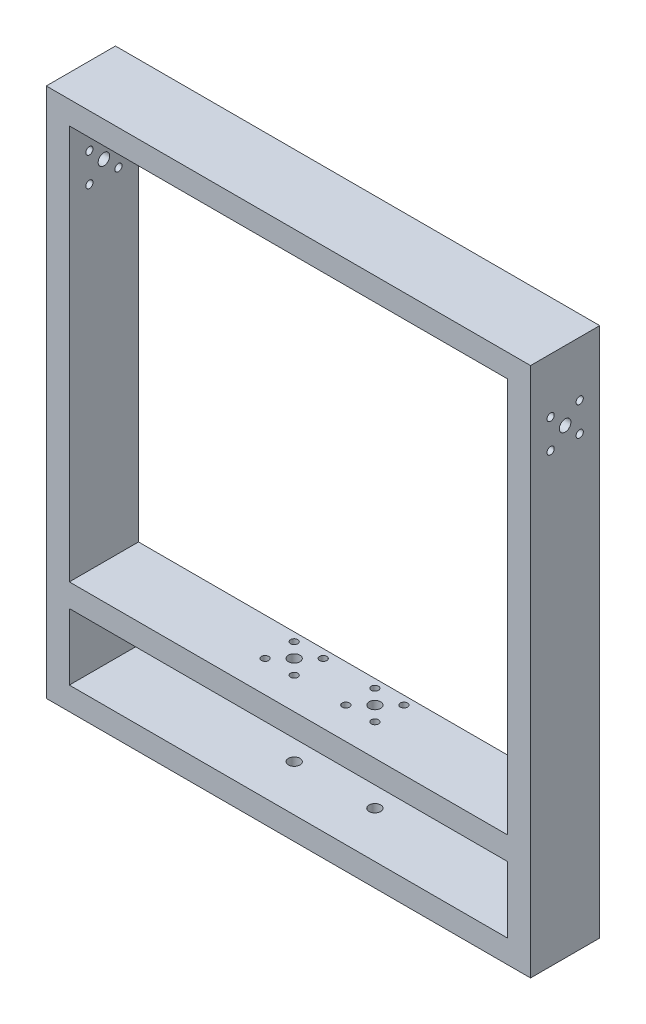
from build123d import *

# Parameters (mm, degrees)
ESQUISSE1_W             = 266.7
ESQUISSE1_H             = 38.1
BOSS_EXTRU_1_DEPTH      = 12.7
ESQUISSE2_W             = 12.7
ESQUISSE2_H             = 38.1
BOSS_EXTRU_2_DEPTH      = 279.4
ESQUISSE3_R             = 3.175
ENL_V_MAT_EXTRU_1_DEPTH = 311.176538442
ESQUISSE4_R             = 3.175
ENL_V_MAT_EXTRU_2_DEPTH = 311.176538442
BOSS_EXTRU_3_REACH      = 389.558
ESQUISSE5_W             = 38.1
ESQUISSE5_H             = 12.7
BOSS_EXTRU_4_REACH      = 389.558
ESQUISSE6_W             = 38.1
ESQUISSE6_H             = 12.7
ESQUISSE9_R             = 3.175
ENL_V_MAT_EXTRU_3_DEPTH = 396.997730423
ESQUISSE10_R            = 2
ENL_V_MAT_EXTRU_4_DEPTH = 396.997730423
ESQUISSE12_R            = 4.7625
ENL_V_MAT_EXTRU_5_DEPTH = 4.7625
ESQUISSE13_R            = 4.7625
ENL_V_MAT_EXTRU_6_DEPTH = 4.7625
ENL_V_START             = -76.2
ESQUISSE17_R            = 3.175
ENL_V_MAT_EXTRU_7_DEPTH = 76.2
ESQUISSE18_R            = 2
ENL_V_MAT_EXTRU_8_DEPTH = 25.4
ESQUISSE20_R            = 3.96875
ENL_V_MAT_EXTRU_9_DEPTH = 4.7625


with BuildPart() as part:
    # Esquisse1 → Boss.-Extru.1 (new body)
    with BuildSketch(Plane(origin=(0, 0, 0), x_dir=(1, 0, 0), z_dir=(0, 1, 0))):
        Rectangle(ESQUISSE1_W, ESQUISSE1_H)
    extrude(amount=BOSS_EXTRU_1_DEPTH)

    # Esquisse2 → Boss.-Extru.2 (add)
    with BuildSketch(Plane(origin=(0, 12.7, 0), x_dir=(1, 0, 0), z_dir=(0, 1, 0))):
        with Locations((-127, 0)):
            Rectangle(ESQUISSE2_W, ESQUISSE2_H)
        with Locations((127, 0)):
            Rectangle(ESQUISSE2_W, ESQUISSE2_H)
    extrude(amount=BOSS_EXTRU_2_DEPTH)

    # Esquisse3 → Enlèv. mat.-Extru.1 (cut, through all)
    with BuildSketch(Plane(origin=(0, 12.7, 0), x_dir=(1, 0, 0), z_dir=(0, 1, 0))):
        with Locations(Location((-22.225, 6.35, 0), (0, 0, 270))):
            Circle(ESQUISSE3_R)
    extrude(amount=-ENL_V_MAT_EXTRU_1_DEPTH, mode=Mode.SUBTRACT)

    # Esquisse4 → Enlèv. mat.-Extru.2 (cut, through all)
    with BuildSketch(Plane(origin=(0, 12.7, 0), x_dir=(1, 0, 0), z_dir=(0, 1, 0))):
        with Locations(Location((22.225, 6.35, 0), (0, 0, 270))):
            Circle(ESQUISSE4_R)
    extrude(amount=-ENL_V_MAT_EXTRU_2_DEPTH, mode=Mode.SUBTRACT)

    # Esquisse5 → Boss.-Extru.3 (add, up to next)
    with BuildSketch(Plane(origin=(-120.65, 0, 0), x_dir=(0, 0, -1), z_dir=(1, 0, 0)), mode=Mode.PRIVATE) as boss_extru_3_sk1:
        with Locations((0, 55.5625)):
            Rectangle(ESQUISSE5_W, ESQUISSE5_H)
    boss_extru_3_tool1 = extrude(boss_extru_3_sk1.sketch, amount=BOSS_EXTRU_3_REACH, mode=Mode.PRIVATE) - part.part
    add(boss_extru_3_tool1.solids().sort_by_distance((-120.65, 55.5625, 0))[0])

    # Esquisse6 → Boss.-Extru.4 (add, up to next)
    with BuildSketch(Plane(origin=(-120.65, 0, 0), x_dir=(0, 0, -1), z_dir=(1, 0, 0)), mode=Mode.PRIVATE) as boss_extru_4_sk1:
        with Locations((0, 285.75)):
            Rectangle(ESQUISSE6_W, ESQUISSE6_H)
    boss_extru_4_tool1 = extrude(boss_extru_4_sk1.sketch, amount=BOSS_EXTRU_4_REACH, mode=Mode.PRIVATE) - part.part
    add(boss_extru_4_tool1.solids().sort_by_distance((-120.65, 285.75, 0))[0])

    # Esquisse9 → Enlèv. mat.-Extru.3 (cut, through all)
    with BuildSketch(Plane.ZY.offset(133.35)):
        with Locations((0, 254)):
            Circle(ESQUISSE9_R)
    extrude(amount=-ENL_V_MAT_EXTRU_3_DEPTH, mode=Mode.SUBTRACT)

    # Esquisse10 → Enlèv. mat.-Extru.4 (cut, through all)
    with BuildSketch(Plane.ZY.offset(133.35)):
        with Locations((8, 262)):
            Circle(ESQUISSE10_R)
        with Locations((-8, 262)):
            Circle(ESQUISSE10_R)
        with Locations((-8, 246)):
            Circle(ESQUISSE10_R)
        with Locations((8, 246)):
            Circle(ESQUISSE10_R)
    extrude(amount=-ENL_V_MAT_EXTRU_4_DEPTH, mode=Mode.SUBTRACT)

    # Esquisse12 → Enlèv. mat.-Extru.5 (cut)
    with BuildSketch(Plane.ZY.offset(133.35)):
        with Locations((8, 262)):
            Circle(ESQUISSE12_R)
        with Locations((-8, 262)):
            Circle(ESQUISSE12_R)
        with Locations((-8, 246)):
            Circle(ESQUISSE12_R)
        with Locations((8, 246)):
            Circle(ESQUISSE12_R)
    extrude(amount=-ENL_V_MAT_EXTRU_5_DEPTH, mode=Mode.SUBTRACT)

    # Esquisse13 → Enlèv. mat.-Extru.6 (cut)
    with BuildSketch(Plane(origin=(120.65, 0, 0), x_dir=(0, 0, -1), z_dir=(1, 0, 0))):
        with Locations(Location((8, 262, 0), (0, 0, 180))):
            Circle(ESQUISSE13_R)
        with Locations(Location((8, 246, 0), (0, 0, 180))):
            Circle(ESQUISSE13_R)
        with Locations(Location((-8, 246, 0), (0, 0, 180))):
            Circle(ESQUISSE13_R)
        with Locations(Location((-8, 262, 0), (0, 0, 180))):
            Circle(ESQUISSE13_R)
    extrude(amount=ENL_V_MAT_EXTRU_6_DEPTH, mode=Mode.SUBTRACT)

    # Esquisse17 → Enlèv. mat.-Extru.7 (cut)
    with BuildSketch(Plane.XZ.offset(ENL_V_START)):
        with Locations(Location((22.225, -6.35, 0), (0, 0, 90))):
            Circle(ESQUISSE17_R)
        with Locations(Location((-22.225, -6.35, 0), (0, 0, 90))):
            Circle(ESQUISSE17_R)
    extrude(amount=ENL_V_MAT_EXTRU_7_DEPTH, mode=Mode.SUBTRACT)

    # Esquisse18 → Enlèv. mat.-Extru.8 (cut)
    with BuildSketch(Plane(origin=(0, 61.9125, 0), x_dir=(1, 0, 0), z_dir=(0, 1, 0))):
        with Locations(Location((14.225, -1.65, 0), (0, 0, 270))):
            Circle(ESQUISSE18_R)
        with Locations(Location((14.225, 14.35, 0), (0, 0, 270))):
            Circle(ESQUISSE18_R)
        with Locations(Location((30.225, 14.35, 0), (0, 0, 270))):
            Circle(ESQUISSE18_R)
        with Locations(Location((30.225, -1.65, 0), (0, 0, 270))):
            Circle(ESQUISSE18_R)
        with Locations(Location((-14.225, -1.65, 0), (0, 0, 270))):
            Circle(ESQUISSE18_R)
        with Locations(Location((-30.225, -1.65, 0), (0, 0, 270))):
            Circle(ESQUISSE18_R)
        with Locations(Location((-30.225, 14.35, 0), (0, 0, 270))):
            Circle(ESQUISSE18_R)
        with Locations(Location((-14.225, 14.35, 0), (0, 0, 270))):
            Circle(ESQUISSE18_R)
    extrude(amount=-ENL_V_MAT_EXTRU_8_DEPTH, mode=Mode.SUBTRACT)

    # Esquisse20 → Enlèv. mat.-Extru.9 (cut)
    with BuildSketch(Plane.XZ.offset(-49.2125)):
        with Locations(Location((30.225, -14.35, 0), (0, 0, 270))):
            Circle(ESQUISSE20_R)
        with Locations(Location((14.225, -14.35, 0), (0, 0, 270))):
            Circle(ESQUISSE20_R)
        with Locations(Location((14.225, 1.65, 0), (0, 0, 270))):
            Circle(ESQUISSE20_R)
        with Locations(Location((30.225, 1.65, 0), (0, 0, 270))):
            Circle(ESQUISSE20_R)
        with Locations(Location((-14.225, -14.35, 0), (0, 0, 270))):
            Circle(ESQUISSE20_R)
        with Locations(Location((-30.225, -14.35, 0), (0, 0, 270))):
            Circle(ESQUISSE20_R)
        with Locations(Location((-30.225, 1.65, 0), (0, 0, 270))):
            Circle(ESQUISSE20_R)
        with Locations(Location((-14.225, 1.65, 0), (0, 0, 270))):
            Circle(ESQUISSE20_R)
    extrude(amount=-ENL_V_MAT_EXTRU_9_DEPTH, mode=Mode.SUBTRACT)


solid = part.part
